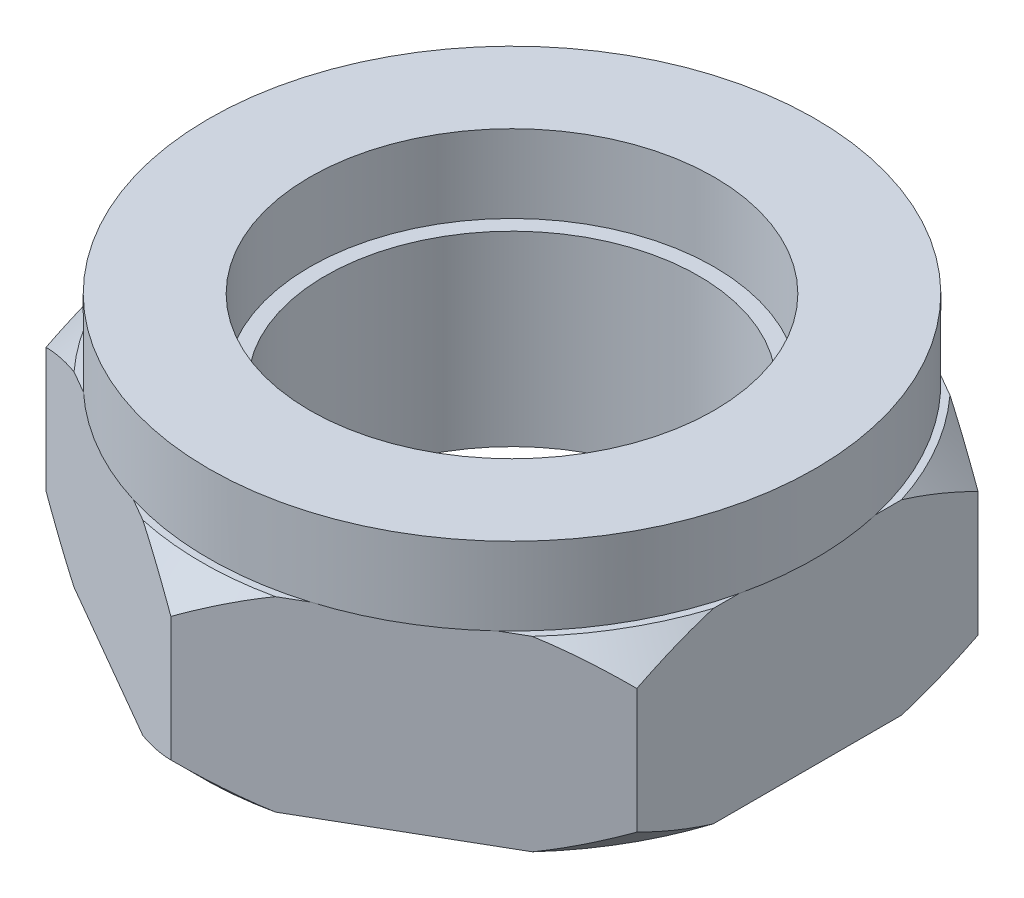
from build123d import *

# Parameters (mm, degrees)
SZKIC1_R                    = 6
DODANIE_WYCI_GNI_CIE1_DEPTH = 3
SZKIC4_R                    = 9.75
SZKIC4_R_2                  = 6.5
DODANIE_WYCI_GNI_CIE2_DEPTH = 2.5


with BuildPart() as part:
    # Szkic1 → Dodanie-wyciągnięcie1 (new, symmetric)
    with BuildSketch(Plane(origin=(0, 0, 0), x_dir=(1, 0, 0), z_dir=(0, 1, 0))):
        Polygon((9.5, -5.484827557), (9.5, 5.484827557), (0, 10.969655115), (-9.5, 5.484827557), (-9.5, -5.484827557), (0, -10.969655115), align=None)
        with Locations(Location((0, 0, 0), (0, 0, 270))):
            Circle(SZKIC1_R, mode=Mode.SUBTRACT)
    extrude(amount=DODANIE_WYCI_GNI_CIE1_DEPTH, both=True)

    # Szkic3 → Wycięcie-obrót9 (revolve, cut)
    with BuildSketch(Plane(origin=(0, 0, 0), x_dir=(0, 0, -1), z_dir=(1, 0, 0))):
        Polygon((10.969655115, 3), (10.969655115, 2), (9.969655115, 3), align=None)
        Polygon((9.969655115, -3), (10.969655115, -3), (10.969655115, -2), align=None)
    revolve(axis=Axis((0, 0, 0), (0, 1, 0)), mode=Mode.SUBTRACT)

    # Szkic4 → Dodanie-wyciągnięcie2 (add)
    with BuildSketch(Plane(origin=(0, 3, 0), x_dir=(1, 0, 0), z_dir=(0, 1, 0))):
        with Locations(Location((0, 0, 0), (0, 0, 106.997175533))):
            Circle(SZKIC4_R)
        with Locations(Location((0, 0, 0), (0, 0, 270))):
            Circle(SZKIC4_R_2, mode=Mode.SUBTRACT)
    extrude(amount=DODANIE_WYCI_GNI_CIE2_DEPTH)


solid = part.part
